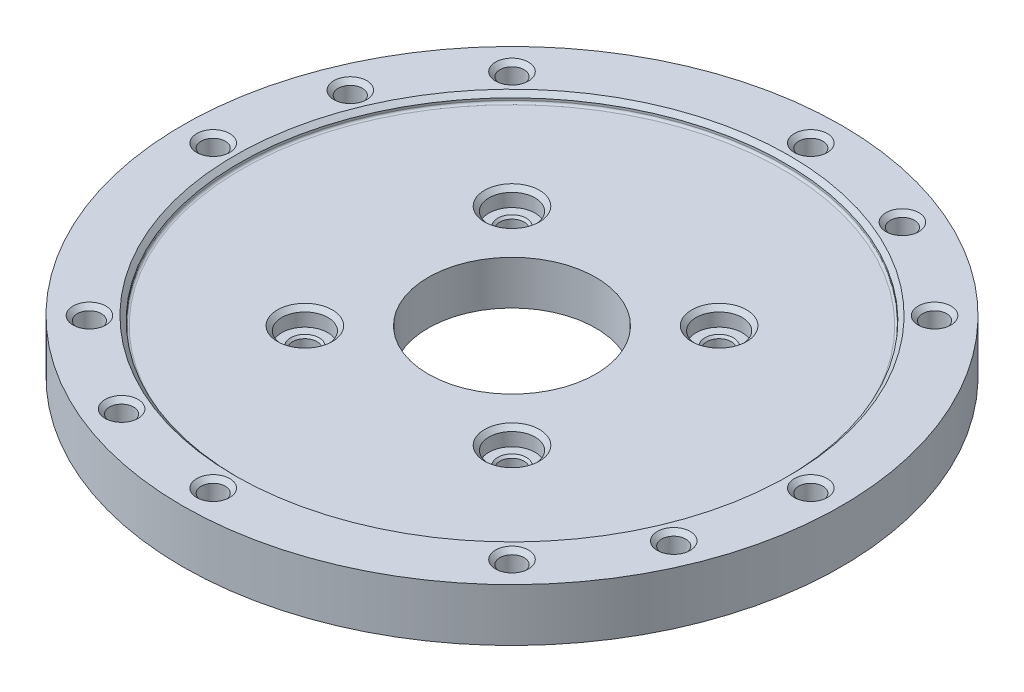
from build123d import *

# Parameters (mm, degrees)
SKETCH1_R           = 75
SKETCH1_R_2         = 19.075
BOSS_EXTRUDE1_DEPTH = 12
SKETCH2_R           = 2.75
CUT_EXTRUDE1_DEPTH  = 107.742681248
SKETCH3_R           = 5.25
CUT_EXTRUDE2_DEPTH  = 6
SKETCH4_R           = 62.1
CUT_EXTRUDE3_DEPTH  = 2
SKETCH5_R           = 2.75
CUT_EXTRUDE4_DEPTH  = 107.742681248
SKETCH8_R           = 5.5
CUT_EXTRUDE5_DEPTH  = 5
FILLET1_R           = 0.5
CHAMFER1_SIZE       = 1
CHAMFER2_SIZE       = 1
CHAMFER3_SIZE       = 1
CHAMFER4_SIZE       = 0.5


with BuildPart() as part:
    # Sketch1 → Boss-Extrude1 (new body)
    with BuildSketch(Plane(origin=(0, 0, 0), x_dir=(1, 0, 0), z_dir=(0, 1, 0))):
        Circle(SKETCH1_R)
        Circle(SKETCH1_R_2, mode=Mode.SUBTRACT)
    extrude(amount=BOSS_EXTRUDE1_DEPTH)

    # Sketch2 → Cut-Extrude1 (cut, through all)
    with BuildSketch(Plane(origin=(0, 12, 0), x_dir=(1, 0, 0), z_dir=(0, 1, 0))):
        with Locations((-23.57, 23.57)):
            Circle(SKETCH2_R)
        with Locations((23.57, 23.57)):
            Circle(SKETCH2_R)
        with Locations((-23.57, -23.57)):
            Circle(SKETCH2_R)
        with Locations((23.57, -23.57)):
            Circle(SKETCH2_R)
    extrude(amount=-CUT_EXTRUDE1_DEPTH, mode=Mode.SUBTRACT)

    # Sketch3 → Cut-Extrude2 (cut)
    with BuildSketch(Plane(origin=(0, 12, 0), x_dir=(1, 0, 0), z_dir=(0, 1, 0))):
        with Locations((-23.57, 23.57)):
            Circle(SKETCH3_R)
        with Locations((23.57, 23.57)):
            Circle(SKETCH3_R)
        with Locations((-23.57, -23.57)):
            Circle(SKETCH3_R)
        with Locations((23.57, -23.57)):
            Circle(SKETCH3_R)
    extrude(amount=-CUT_EXTRUDE2_DEPTH, mode=Mode.SUBTRACT)

    # Sketch4 → Cut-Extrude3 (cut)
    with BuildSketch(Plane(origin=(0, 12, 0), x_dir=(1, 0, 0), z_dir=(0, 1, 0))):
        Circle(SKETCH4_R)
    extrude(amount=-CUT_EXTRUDE3_DEPTH, mode=Mode.SUBTRACT)

    # Sketch5 → Cut-Extrude4 (cut, through all)
    with BuildSketch(Plane(origin=(0, 12, 0), x_dir=(1, 0, 0), z_dir=(0, 1, 0))):
        with Locations((0, 68)):
            Circle(SKETCH5_R)
        with Locations((48.083261121, 48.083261121)):
            Circle(SKETCH5_R)
        with Locations((68, 0)):
            Circle(SKETCH5_R)
        with Locations((48.083261121, -48.083261121)):
            Circle(SKETCH5_R)
        with Locations((0, -68)):
            Circle(SKETCH5_R)
        with Locations((-48.083261121, -48.083261121)):
            Circle(SKETCH5_R)
        with Locations((-68, 0)):
            Circle(SKETCH5_R)
        with Locations((-48.083261121, 48.083261121)):
            Circle(SKETCH5_R)
        with Locations((26.022473401, 62.823808211)):
            Circle(SKETCH5_R)
        with Locations((62.823808211, -26.022473401)):
            Circle(SKETCH5_R)
        with Locations((-26.022473401, -62.823808211)):
            Circle(SKETCH5_R)
        with Locations((-62.823808211, 26.022473401)):
            Circle(SKETCH5_R)
    extrude(amount=-CUT_EXTRUDE4_DEPTH, mode=Mode.SUBTRACT)

    # Sketch8 → Cut-Extrude5 (cut)
    with BuildSketch(Plane.XZ):
        with Locations((0, 68)):
            Circle(SKETCH8_R)
        with Locations((-48.083261121, 48.083261121)):
            Circle(SKETCH8_R)
        with Locations((48.083261121, 48.083261121)):
            Circle(SKETCH8_R)
        with Locations((48.083261121, -48.083261121)):
            Circle(SKETCH8_R)
        with Locations((0, -68)):
            Circle(SKETCH8_R)
        with Locations((-48.083261121, -48.083261121)):
            Circle(SKETCH8_R)
        with Locations((-68, 0)):
            Circle(SKETCH8_R)
        with Locations((68, 0)):
            Circle(SKETCH8_R)
    extrude(amount=-CUT_EXTRUDE5_DEPTH, mode=Mode.SUBTRACT)

    # Fillet1
    fillet1_edges = [part.edges().sort_by_distance(p)[0] for p in [
        (-62.1, 10, 0),
    ]]
    fillet(fillet1_edges, radius=FILLET1_R)

    # Chamfer1
    chamfer1_edges = [part.edges().sort_by_distance(p)[0] for p in [
        (-62.1, 12, 0),
    ]]
    chamfer(chamfer1_edges, length=CHAMFER1_SIZE)

    # Chamfer2
    chamfer2_edges = [part.edges().sort_by_distance(p)[0] for p in [
        (-2.75, 12, 68),
        (-70.75, 12, 0),
        (-50.833261121, 12, 48.083261121),
        (45.333261121, 12, 48.083261121),
        (65.25, 12, 0),
        (45.333261121, 12, -48.083261121),
        (23.272473401, 12, -62.823808211),
        (-2.75, 12, -68),
        (-50.833261121, 12, -48.083261121),
        (-28.82, 10, -23.57),
        (18.32, 10, -23.57),
        (18.32, 10, 23.57),
        (-28.82, 10, 23.57),
        (60.073808211, 12, 26.022473401),
        (-28.772473401, 12, 62.823808211),
        (-65.573808211, 12, -26.022473401),
    ]]
    chamfer(chamfer2_edges, length=CHAMFER2_SIZE)

    # Chamfer3
    chamfer3_edges = [part.edges().sort_by_distance(p)[0] for p in [
        (-5.5, 0, 68),
        (42.583261121, 0, 48.083261121),
        (62.5, 0, 0),
        (42.583261121, 0, -48.083261121),
        (-5.5, 0, -68),
        (-53.583261121, 0, -48.083261121),
        (-73.5, 0, 0),
        (-53.583261121, 0, 48.083261121),
    ]]
    chamfer(chamfer3_edges, length=CHAMFER3_SIZE)

    # Chamfer4
    chamfer4_edges = [part.edges().sort_by_distance(p)[0] for p in [
        (-26.32, 6, 23.57),
        (20.82, 6, 23.57),
        (20.82, 6, -23.57),
        (-26.32, 6, -23.57),
    ]]
    chamfer(chamfer4_edges, length=CHAMFER4_SIZE)


solid = part.part
